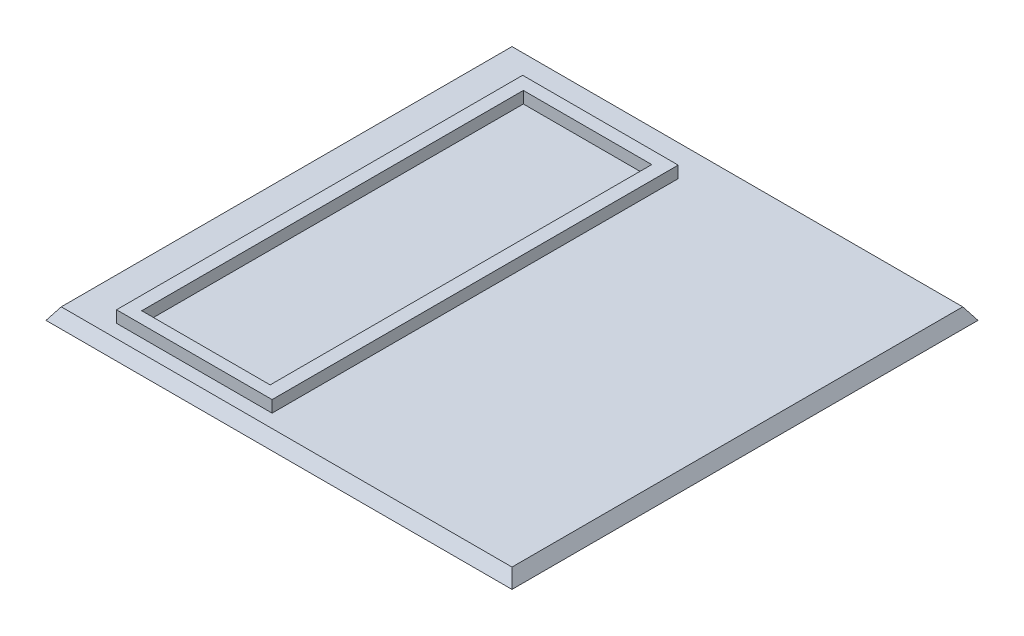
from build123d import *

# Parameters (mm, degrees)
SKETCH1_W           = 201.6125
SKETCH1_H           = 201.6125
BOSS_EXTRUDE1_DEPTH = 5.08
BOSS_EXTRUDE1_TAPER = 33
SKETCH2_W           = 67.31
SKETCH2_H           = 175.708748127
SKETCH2_W_2         = 55.5625
SKETCH2_H_2         = 165.1
BOSS_EXTRUDE3_DEPTH = 5.08


with BuildPart() as part:
    # Sketch1 → Boss-Extrude1 (new body)
    with BuildSketch(Plane(origin=(0, 0, 0), x_dir=(1, 0, 0), z_dir=(0, 1, 0))):
        with Locations((55.240442456, 31.631215749)):
            Rectangle(SKETCH1_W, SKETCH1_H)
    extrude(amount=BOSS_EXTRUDE1_DEPTH, taper=BOSS_EXTRUDE1_TAPER)

    # Sketch2 → Boss-Extrude3 (add)
    with BuildSketch(Plane(origin=(0, 5.08, 0), x_dir=(1, 0, 0), z_dir=(0, 1, 0))):
        with Locations((9.525, 27.753321004)):
            Rectangle(SKETCH2_W, SKETCH2_H)
        with Locations((9.475412799, 27.530326262)):
            Rectangle(SKETCH2_W_2, SKETCH2_H_2, mode=Mode.SUBTRACT)
    extrude(amount=BOSS_EXTRUDE3_DEPTH)


solid = part.part
